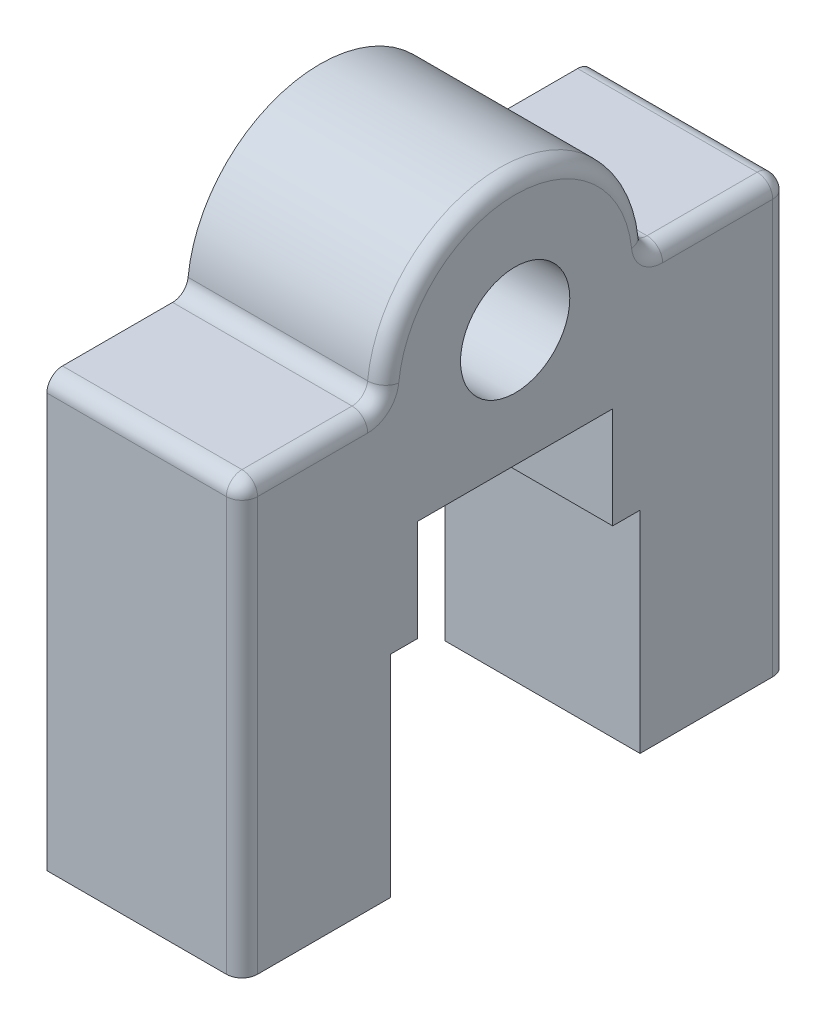
from build123d import *

# Parameters (mm, degrees)
SKETCH1_R           = 7
BOSS_EXTRUDE1_DEPTH = 25
CUT_EXTRUDE1_DEPTH  = 84.868945385
FILLET1_R           = 2
FILLET2_R           = 2


with BuildPart() as part:
    # Sketch1 → Boss-Extrude1 (new body)
    with BuildSketch(Plane(origin=(0, 0, 0), x_dir=(0, 0, -1), z_dir=(1, 0, 0))):
        with BuildLine():
            Line((17, 55), (35, 55))
            Line((35, 55), (35, 0))
            Line((35, 0), (-35, 0))
            Line((-35, 0), (-35, 55))
            Line((-35, 55), (-17, 55))
            ThreePointArc((-17, 55), (0, 72), (17, 55))
        make_face()
        with Locations((0, 55)):
            Circle(SKETCH1_R, mode=Mode.SUBTRACT)
    extrude(amount=BOSS_EXTRUDE1_DEPTH)

    # Sketch2 → Cut-Extrude1 (cut, through all)
    with BuildSketch(Plane(origin=(25, 0, 0), x_dir=(0, 0, -1), z_dir=(1, 0, 0))):
        Polygon((-16, 27), (-12.5, 27), (-12.5, 40), (12.5, 40), (12.5, 27), (16, 27), (16, 0), (-16, 0), align=None)
    extrude(amount=-CUT_EXTRUDE1_DEPTH, mode=Mode.SUBTRACT)

    # Fillet1
    fillet1_edges = [part.edges().sort_by_distance(p)[0] for p in [
        (12.5, 55, -35),
        (12.5, 55, -17),
        (12.5, 55, 17),
        (12.5, 55, 35),
    ]]
    fillet(fillet1_edges, radius=FILLET1_R)

    # Fillet2
    fillet2_edges = [part.edges().sort_by_distance(p)[0] for p in [
        (25, 26.5, 35),
        (25, 54.414213562, 34.414213562),
        (25, 55, 25.947221814),
        (25, 55.513216117, 17.55673152),
        (25, 72, 0),
        (25, 55.513216117, -17.55673152),
        (25, 55, -25.947221814),
        (25, 54.414213562, -34.414213562),
        (25, 26.5, -35),
    ]]
    fillet(fillet2_edges, radius=FILLET2_R)


solid = part.part
